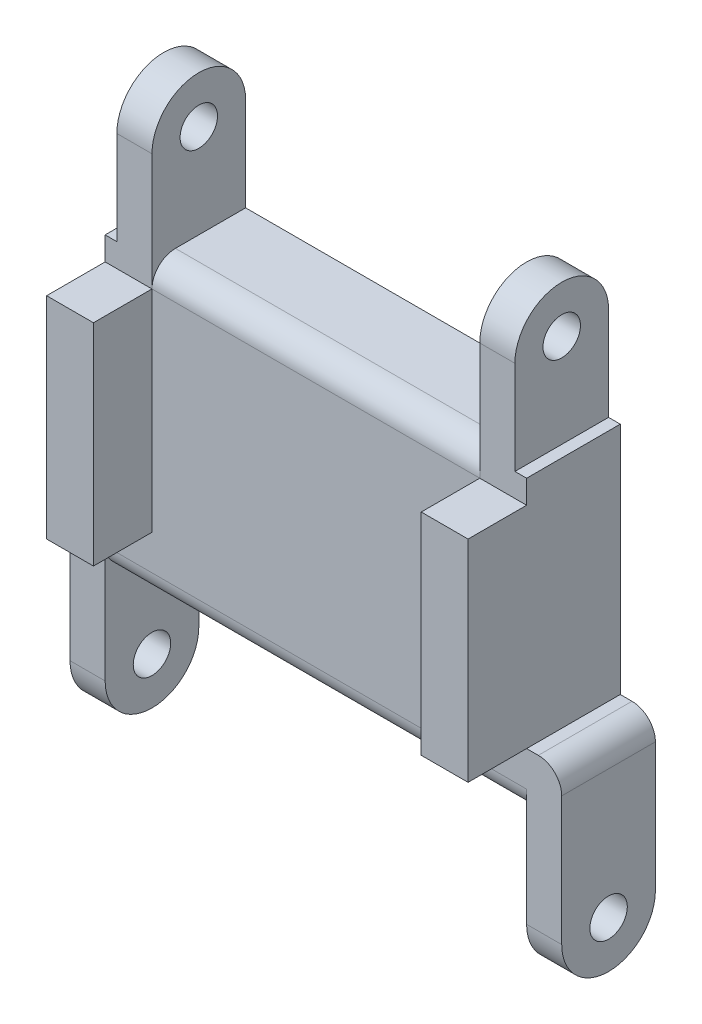
from build123d import *

# Parameters (mm, degrees)
SKETCH_1_W      = 36
SKETCH_1_H      = 25
EXTRUDE_1_DEPTH = 8
EXTRUDE_START   = -1
SKETCH_2_R      = 1.6
EXTRUDE_2_DEPTH = 3
EXTRUDE_START_2 = -32
SKETCH_2_3_R    = 1.6
EXTRUDE_3_DEPTH = 3
SKETCH_4_R      = 1.6
EXTRUDE_4_DEPTH = 3
FILLET_2_R      = 2
EXTRUDE_START_3 = -39
SKETCH_4_3_R    = 1.6
EXTRUDE_5_DEPTH = 3
FILLET_3_R      = 2
FILLET_4_R      = 2
FILLET_5_R      = 2
SKETCH_5_W      = 4
SKETCH_5_H      = 18
EXTRUDE_6_DEPTH = 5


with BuildPart() as part:
    # Эскиз1 → Бобышка-Вытянуть1 (new body)
    with BuildSketch(Plane.XY):
        with Locations((18, 12.5)):
            Rectangle(SKETCH_1_W, SKETCH_1_H)
    extrude(amount=EXTRUDE_1_DEPTH)

    # Эскиз2 → Бобышка-Вытянуть2 (add)
    with BuildSketch(Plane(origin=(36, 0, 0), x_dir=(0, 0, -1), z_dir=(1, 0, 0)).offset(EXTRUDE_START)):
        with BuildLine():
            Line((-8, 25), (0, 25))
            Line((0, 25), (0, 33))
            ThreePointArc((0, 33), (-4, 37), (-8, 33))
            Line((-8, 33), (-8, 25))
        make_face()
        with Locations((-4, 33)):
            Circle(SKETCH_2_R, mode=Mode.SUBTRACT)
    extrude(amount=-EXTRUDE_2_DEPTH)

    # Эскиз2<3> → Бобышка-Вытянуть3 (add)
    with BuildSketch(Plane(origin=(36, 0, 0), x_dir=(0, 0, -1), z_dir=(1, 0, 0)).offset(EXTRUDE_START_2)):
        with BuildLine():
            Line((-8, 25), (0, 25))
            Line((0, 25), (0, 33))
            ThreePointArc((0, 33), (-4, 37), (-8, 33))
            Line((-8, 33), (-8, 25))
        make_face()
        with Locations((-4, 33)):
            Circle(SKETCH_2_3_R, mode=Mode.SUBTRACT)
    extrude(amount=-EXTRUDE_3_DEPTH)

    # Эскиз4 → Бобышка-Вытянуть4 (add)
    with BuildSketch(Plane.ZY):
        with BuildLine():
            Line((8, -8), (8, 5))
            Line((8, 5), (0, 5))
            Line((0, 5), (0, -8))
            ThreePointArc((0, -8), (4, -12), (8, -8))
        make_face()
        with Locations((4, -8)):
            Circle(SKETCH_4_R, mode=Mode.SUBTRACT)
    extrude(amount=EXTRUDE_4_DEPTH)

    # Скругление2
    fillet_2_edges = [part.edges().sort_by_distance(p)[0] for p in [
        (-3, 5, 4),
    ]]
    fillet(fillet_2_edges, radius=FILLET_2_R)

    # Эскиз4<3> → Бобышка-Вытянуть5 (add)
    with BuildSketch(Plane.ZY.offset(EXTRUDE_START_3)):
        with BuildLine():
            Line((8, -8), (8, 5))
            Line((8, 5), (0, 5))
            Line((0, 5), (0, -8))
            ThreePointArc((0, -8), (4, -12), (8, -8))
        make_face()
        with Locations((4, -8)):
            Circle(SKETCH_4_3_R, mode=Mode.SUBTRACT)
    extrude(amount=EXTRUDE_5_DEPTH)

    # Скругление3
    fillet_3_edges = [part.edges().sort_by_distance(p)[0] for p in [
        (39, 5, 4),
    ]]
    fillet(fillet_3_edges, radius=FILLET_3_R)

    # Скругление4
    fillet_4_edges = [part.edges().sort_by_distance(p)[0] for p in [
        (18, 0, 8),
    ]]
    fillet(fillet_4_edges, radius=FILLET_4_R)

    # Скругление5
    fillet_5_edges = [part.edges().sort_by_distance(p)[0] for p in [
        (18, 25, 8),
    ]]
    fillet(fillet_5_edges, radius=FILLET_5_R)

    # Эскиз5 → Бобышка-Вытянуть6 (add)
    with BuildSketch(Plane.XY.offset(8)):
        with Locations((2, 14)):
            Rectangle(SKETCH_5_W, SKETCH_5_H)
        with Locations((34, 14)):
            Rectangle(SKETCH_5_W, SKETCH_5_H)
    extrude(amount=EXTRUDE_6_DEPTH)


solid = part.part
